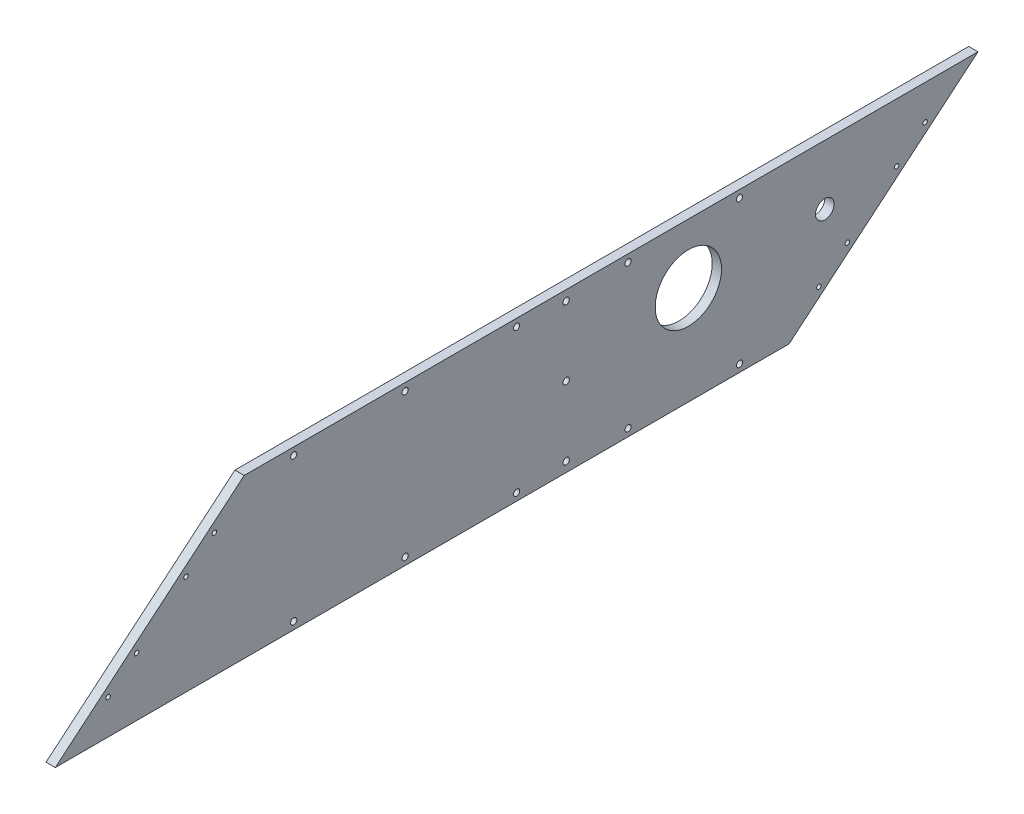
from build123d import *

# Parameters (mm, degrees)
BOSS_EXTRUDE1_DEPTH           = 4.7625
SKETCH2_R                     = 17
SKETCH2_R_2                   = 4.7625
GEARBOX_WITH_PRESS_FITS_DEPTH = 412.602247496
SKETCH3_R                     = 1.58115
CUT_EXTRUDE1_DEPTH            = 412.602247496
F_4_40_TAPPED_HOLE1_D         = 2.2606
F_4_CLEARANCE_HOLE1_D         = 3.2639
F_4_CLEARANCE_HOLE1_DEPTH     = 4.826
F_4_CLEARANCE_HOLE1_TIP       = 0.980574487


with BuildPart() as part:
    # Sketch1 → Boss-Extrude1 (new body)
    with BuildSketch(Plane(origin=(0, 0, 0), x_dir=(0, 0, -1), z_dir=(1, 0, 0))):
        Polygon((33.297595377, -40.64), (312.697595377, -40.64), (345.995190754, -12.7), (409.563327383, 40.64), (312.697595377, 40.64), (33.297595377, 40.64), (0, 12.7), (-63.568136629, -40.64), align=None)
    extrude(amount=BOSS_EXTRUDE1_DEPTH)

    # Sketch2 → Gearbox (with Press fits) (cut, through all)
    with BuildSketch(Plane(origin=(4.7625, 0, 0), x_dir=(0, 0, -1), z_dir=(1, 0, 0))):
        with Locations((261.047997306, 10)):
            Circle(SKETCH2_R)
        with Locations((331.004197306, 10)):
            Circle(SKETCH2_R_2)
    extrude(amount=-GEARBOX_WITH_PRESS_FITS_DEPTH, mode=Mode.SUBTRACT)

    # Sketch3 → Cut-Extrude1 (cut, through all)
    with BuildSketch(Plane(origin=(4.7625, 0, 0), x_dir=(0, 0, -1), z_dir=(1, 0, 0))):
        with Locations((287.297595377, 36.83)):
            Circle(SKETCH3_R)
        with Locations((230.147595377, 36.83)):
            Circle(SKETCH3_R)
        with Locations((172.997595377, 36.83)):
            Circle(SKETCH3_R)
        with Locations((115.847595377, 36.83)):
            Circle(SKETCH3_R)
        with Locations((58.697595377, 36.83)):
            Circle(SKETCH3_R)
        with Locations((58.697595377, -36.83)):
            Circle(SKETCH3_R)
        with Locations((115.847595377, -36.83)):
            Circle(SKETCH3_R)
        with Locations((172.997595377, -36.83)):
            Circle(SKETCH3_R)
        with Locations((230.147595377, -36.83)):
            Circle(SKETCH3_R)
        with Locations((287.297595377, -36.83)):
            Circle(SKETCH3_R)
    extrude(amount=-CUT_EXTRUDE1_DEPTH, mode=Mode.SUBTRACT)

    # #4-40 Tapped Hole1 (through all)
    with Locations(Plane(origin=(4.7625, 0, 0), x_dir=(0, 0, -1), z_dir=(1, 0, 0))):
        with Locations((327.962613202, -22.8575274), (342.555759844, -10.612423436), (367.850547356, 10.612423436), (382.443693997, 22.8575274), (-36.448503243, -22.8575274), (-21.855356602, -10.612423436), (3.43943091, 10.612423436), (18.032577552, 22.8575274)):
            Hole(F_4_40_TAPPED_HOLE1_D / 2)

    # #4 Clearance Hole1
    with Locations(Plane(origin=(4.7625, 0, 0), x_dir=(0, 0, -1), z_dir=(1, 0, 0))):
        with Locations((198.397595377, 35.56), (198.397595377, -35.56), (198.397595377, 0)):
            Hole(F_4_CLEARANCE_HOLE1_D / 2, depth=F_4_CLEARANCE_HOLE1_DEPTH)
            with Locations((0, 0, -(F_4_CLEARANCE_HOLE1_DEPTH + F_4_CLEARANCE_HOLE1_TIP / 2))):  # 118° drill point
                Cone(0, F_4_CLEARANCE_HOLE1_D / 2, F_4_CLEARANCE_HOLE1_TIP, mode=Mode.SUBTRACT)


solid = part.part
